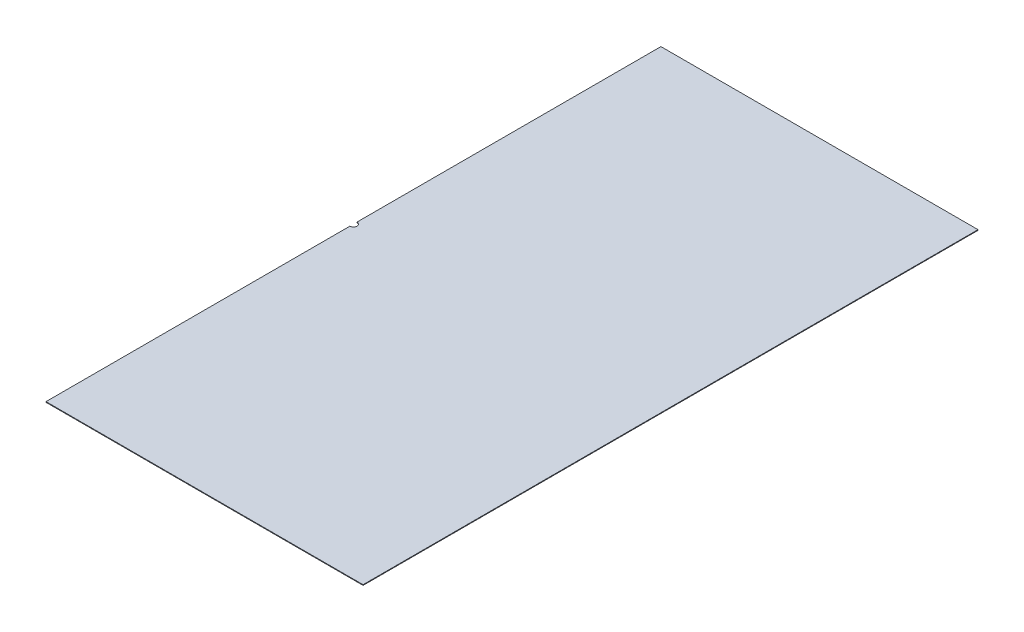
from build123d import *

# Parameters (mm, degrees)
BOSS_EXTRUDE1_DEPTH = 2


with BuildPart() as part:
    # Sketch1 → Boss-Extrude1 (new body)
    with BuildSketch(Plane(origin=(0, 0, 0), x_dir=(1, 0, 0), z_dir=(0, 1, 0))):
        with BuildLine():
            Line((495, -960), (495, 960))
            Line((495, 960), (-495, 960))
            Line((-495, 960), (-495, 11))
            ThreePointArc((-495, 11), (-484, 0), (-495, -11))
            Line((-495, -11), (-495, -960))
            Line((-495, -960), (495, -960))
        make_face()
    extrude(amount=BOSS_EXTRUDE1_DEPTH)


solid = part.part
